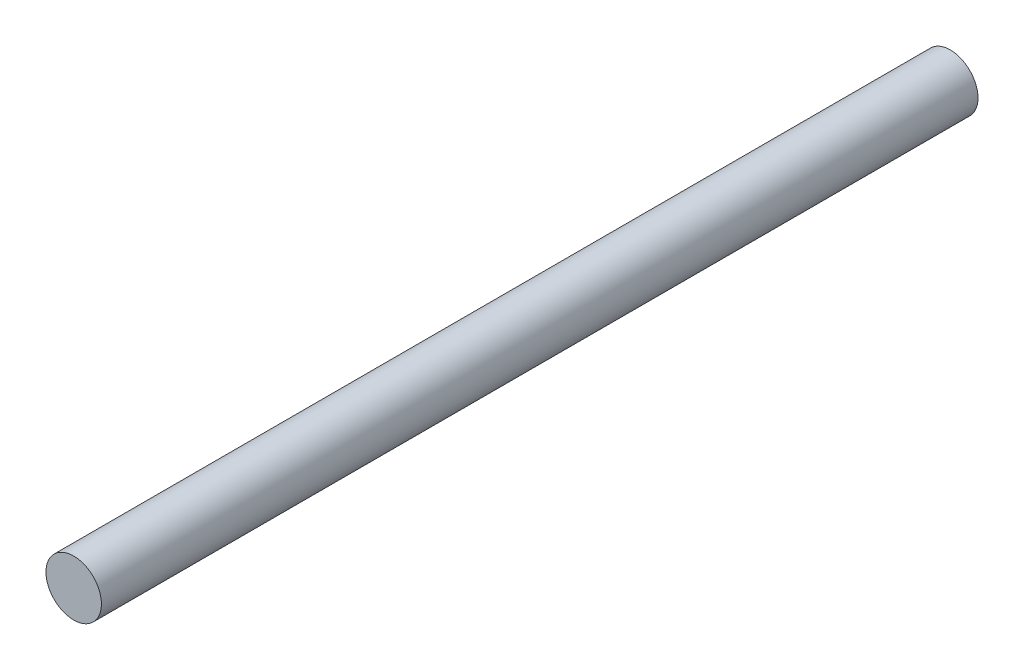
from build123d import *

# Parameters (mm, degrees)
SKETCH1_R           = 3.175
BOSS_EXTRUDE1_DEPTH = 100.33


with BuildPart() as part:
    # Sketch1 → Boss-Extrude1 (new body)
    with BuildSketch(Plane.XY):
        Circle(SKETCH1_R)
    extrude(amount=BOSS_EXTRUDE1_DEPTH)


solid = part.part
